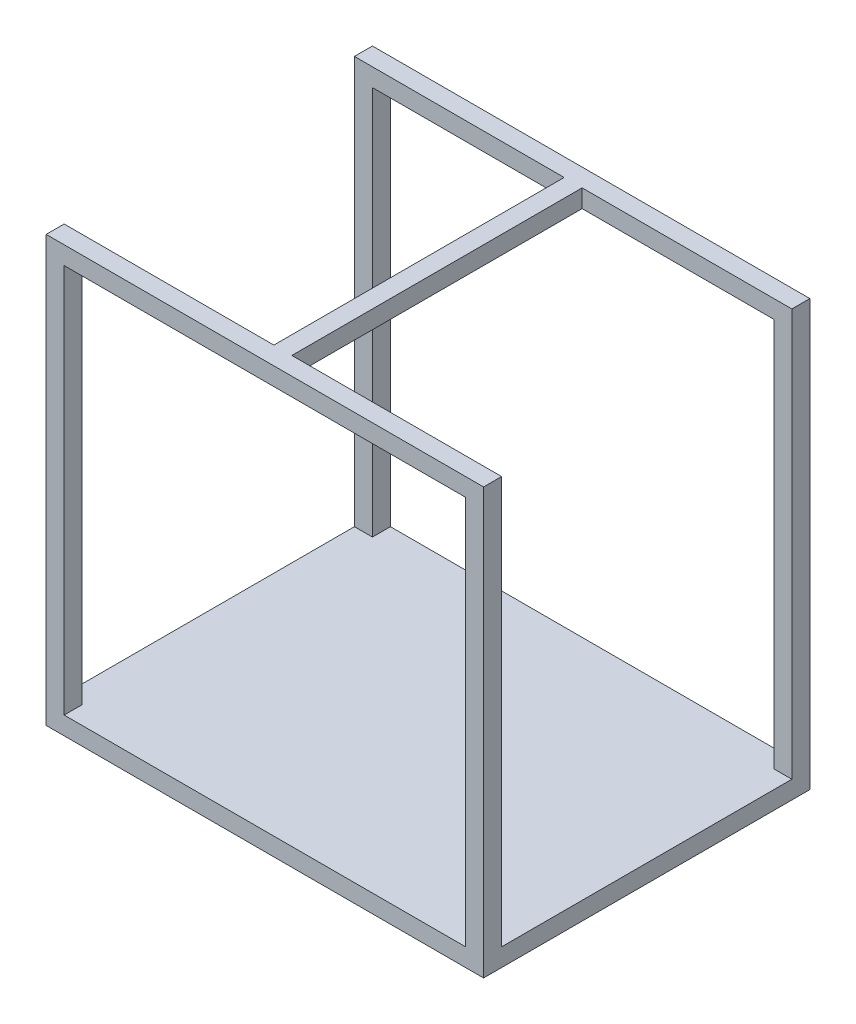
from build123d import *

# Parameters (mm, degrees)
SKETCH1_W           = 460.375
SKETCH1_H           = 600.075
SKETCH1_W_2         = 409.575
SKETCH1_H_2         = 549.275
BOSS_EXTRUDE1_DEPTH = 617.22
SKETCH3_W           = 566.42
SKETCH3_H           = 549.275
CUT_EXTRUDE1_DEPTH  = 828.978611889
CUT_EXTRUDE2_REACH  = 955.867
SKETCH4_W           = 295.91
SKETCH4_H           = 409.575


with BuildPart() as part:
    # Sketch1 → Boss-Extrude1 (new body)
    with BuildSketch(Plane(origin=(0, 0, 0), x_dir=(0, 0, -1), z_dir=(1, 0, 0))):
        with Locations((-180.678434066, 4.335482901)):
            Rectangle(SKETCH1_W, SKETCH1_H)
        with Locations((-180.678434066, 4.335482901)):
            Rectangle(SKETCH1_W_2, SKETCH1_H_2, mode=Mode.SUBTRACT)
    extrude(amount=-BOSS_EXTRUDE1_DEPTH)

    # Sketch3 → Cut-Extrude1 (cut, through all)
    with BuildSketch(Plane.XY.offset(410.865934066)):
        with Locations((-308.61, 4.335482901)):
            Rectangle(SKETCH3_W, SKETCH3_H)
    extrude(amount=-CUT_EXTRUDE1_DEPTH, mode=Mode.SUBTRACT)

    # Sketch4 → Cut-Extrude2 (cut, up to next)
    with BuildSketch(Plane(origin=(0, 304.372982901, 0), x_dir=(1, 0, 0), z_dir=(0, 1, 0)), mode=Mode.PRIVATE) as cut_extrude2_sk1:
        with Locations((-469.265, -180.678434066)):
            Rectangle(SKETCH4_W, SKETCH4_H)
    cut_extrude2_tool1 = extrude(cut_extrude2_sk1.sketch, amount=-CUT_EXTRUDE2_REACH, mode=Mode.PRIVATE) & part.part
    # Sketch4 → Cut-Extrude2 (cut, up to next)
    with BuildSketch(Plane(origin=(0, 304.372982901, 0), x_dir=(1, 0, 0), z_dir=(0, 1, 0)), mode=Mode.PRIVATE) as cut_extrude2_sk2:
        with Locations((-147.955, -180.678434066)):
            Rectangle(SKETCH4_W, SKETCH4_H)
    cut_extrude2_tool2 = extrude(cut_extrude2_sk2.sketch, amount=-CUT_EXTRUDE2_REACH, mode=Mode.PRIVATE) & part.part
    add(cut_extrude2_tool1.solids().sort_by_distance((-469.265, 304.372983, 180.678434))[0], mode=Mode.SUBTRACT)
    add(cut_extrude2_tool2.solids().sort_by_distance((-147.955, 304.372983, 180.678434))[0], mode=Mode.SUBTRACT)


solid = part.part
